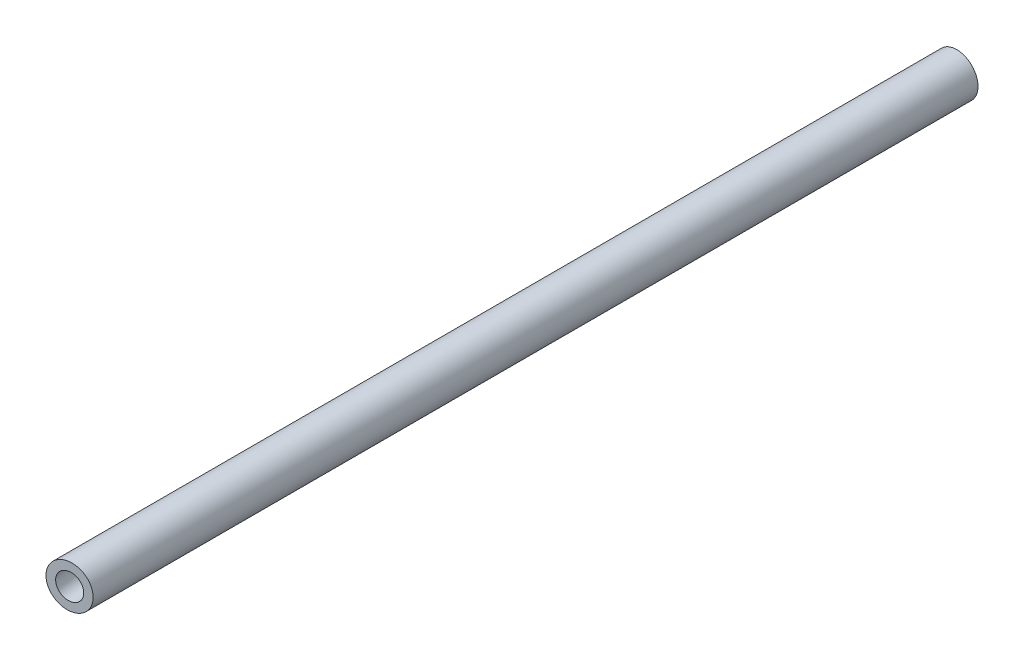
from build123d import *

# Parameters (mm, degrees)
SZKIC1_R                        = 10
DODANIE_WYCI_GNI_CIE1_DEPTH     = 500
SZKIC2_R                        = 6
WYTNIJ_WYCI_GNI_CIE1_DEPTH      = 118
WYTNIJ_WYCI_GNI_CIE2_DEPTH      = 35
WYTNIJ_WYCI_GNI_CIE2_DEPTH_BACK = 35
SZKIC4_R                        = 6
WYTNIJ_WYCI_GNI_CIE3_DEPTH      = 35
WYTNIJ_WYCI_GNI_CIE4_DEPTH      = 20
WYTNIJ_WYCI_GNI_CIE4_DEPTH_BACK = 20
SZKIC5_W                        = 20
SZKIC5_H                        = 83


with BuildPart() as part:
    # Szkic1 → Dodanie-wyciągnięcie1 (new body)
    with BuildSketch(Plane.XY):
        Circle(SZKIC1_R)
    extrude(amount=DODANIE_WYCI_GNI_CIE1_DEPTH)

    # Szkic2 → Wytnij-wyciągnięcie1 (cut)
    with BuildSketch(Plane(origin=(0, 0, 0), x_dir=(-1, 0, 0), z_dir=(0, 0, -1))):
        Circle(SZKIC2_R)
    extrude(amount=-WYTNIJ_WYCI_GNI_CIE1_DEPTH, mode=Mode.SUBTRACT)

    # Szkic3 → Wytnij-wyciągnięcie2 (cut, two sides: drawn at the far end of the back side and taken through both)
    with BuildSketch(Plane(origin=(0, 0, 0), x_dir=(1, 0, 0), z_dir=(0, 1, 0)).offset(-WYTNIJ_WYCI_GNI_CIE2_DEPTH_BACK)):
        Polygon((-10, -500), (10, -500), (15.054630998, -497.366652169), align=None)
    extrude(amount=WYTNIJ_WYCI_GNI_CIE2_DEPTH + WYTNIJ_WYCI_GNI_CIE2_DEPTH_BACK, mode=Mode.SUBTRACT)

    # Szkic4 → Wytnij-wyciągnięcie3 (cut)
    with BuildSketch(Plane(origin=(51.868660708, 0, 493.497341729), x_dir=(0.9945218953682733, 0, -0.10452846326765462), z_dir=(0.10452846326765461, 0, 0.9945218953682732))):
        with Locations((-52.099435871, 0)):
            Circle(SZKIC4_R)
    extrude(amount=-WYTNIJ_WYCI_GNI_CIE3_DEPTH, mode=Mode.SUBTRACT)

    # Szkic5 → Wytnij-wyciągnięcie4 (cut, two sides: drawn at the far end of the back side and taken through both)
    with BuildSketch(Plane(origin=(0, 0, 0), x_dir=(1, 0, 0), z_dir=(0, 1, 0)).offset(-WYTNIJ_WYCI_GNI_CIE4_DEPTH_BACK)):
        with Locations((0, -41.5)):
            Rectangle(SZKIC5_W, SZKIC5_H)
    extrude(amount=WYTNIJ_WYCI_GNI_CIE4_DEPTH + WYTNIJ_WYCI_GNI_CIE4_DEPTH_BACK, mode=Mode.SUBTRACT)


solid = part.part
